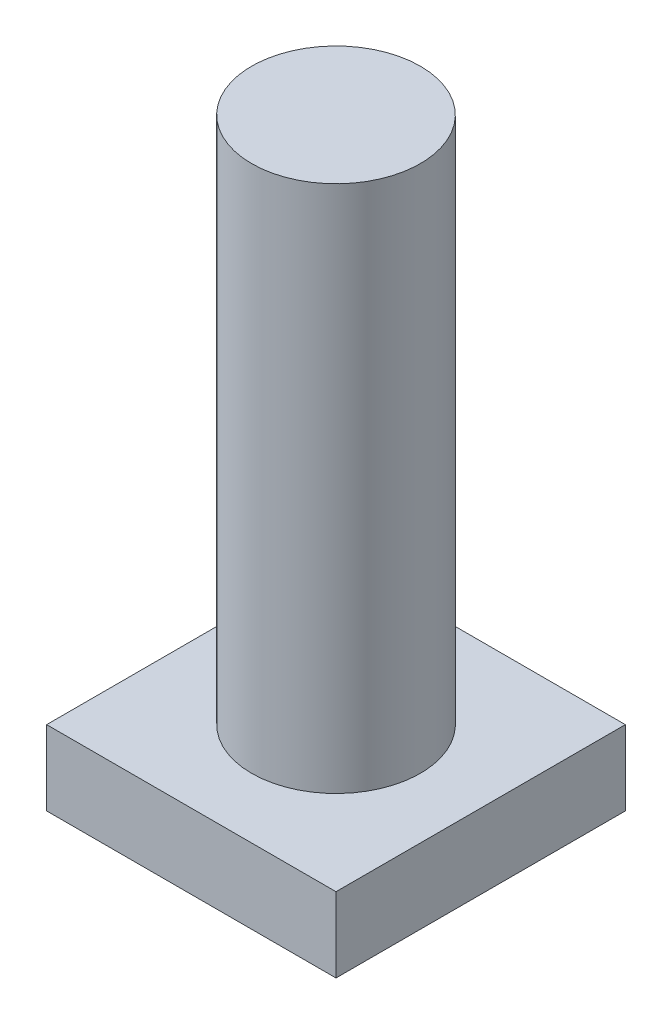
from build123d import *

# Parameters (mm, degrees)
SKETCH_1_W      = 12
SKETCH_1_H      = 12
EXTRUDE_1_DEPTH = 3.1
SKETCH_2_R      = 3.5
EXTRUDE_2_DEPTH = 21.9


with BuildPart() as part:
    # 草图1 → 拉伸1 (new body)
    with BuildSketch(Plane(origin=(0, 0, 0), x_dir=(1, 0, 0), z_dir=(0, 1, 0))):
        Rectangle(SKETCH_1_W, SKETCH_1_H)
    extrude(amount=EXTRUDE_1_DEPTH)

    # 草图2 → 拉伸2 (add)
    with BuildSketch(Plane(origin=(0, 3.1, 0), x_dir=(-1, 0, 0), z_dir=(0, 1, 0))):
        with Locations(Location((0, 0, 0), (0, 0, 90))):
            Circle(SKETCH_2_R)
    extrude(amount=EXTRUDE_2_DEPTH)


solid = part.part
